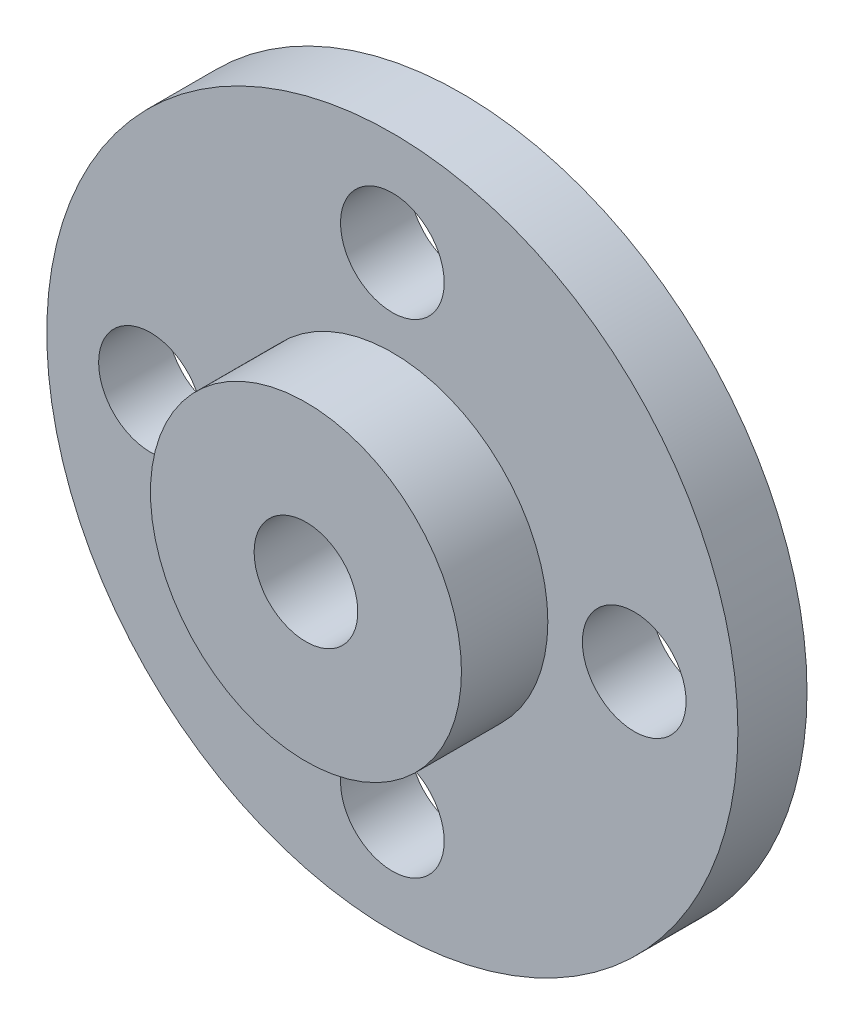
from build123d import *

# Parameters (mm, degrees)
SKETCH_1_R          = 10
EXTRUDE_1_DEPTH     = 2
SKETCH_2_R          = 4.5
EXTRUDE_2_DEPTH     = 2.5
SKETCH_3_R          = 1.5
CUT_EXTRUDE_1_DEPTH = 2.5
SKETCH_4_R          = 1.5
CUT_EXTRUDE_2_DEPTH = 15.84082208


with BuildPart() as part:
    # 草图1 → 凸台-拉伸1 (new body)
    with BuildSketch(Plane.XY):
        Circle(SKETCH_1_R)
    extrude(amount=EXTRUDE_1_DEPTH)

    # 草图2 → 凸台-拉伸2 (add)
    with BuildSketch(Plane.XY.offset(2)):
        Circle(SKETCH_2_R)
    extrude(amount=EXTRUDE_2_DEPTH)

    # 草图3 → 切除-拉伸1 (cut)
    with BuildSketch(Plane(origin=(0, 0, 0), x_dir=(-1, 0, 0), z_dir=(0, 0, -1))):
        with Locations((0, 7)):
            Circle(SKETCH_3_R)
        with Locations((7, 0)):
            Circle(SKETCH_3_R)
        with Locations((0, -7)):
            Circle(SKETCH_3_R)
        with Locations((-7, 0)):
            Circle(SKETCH_3_R)
    extrude(amount=-CUT_EXTRUDE_1_DEPTH, mode=Mode.SUBTRACT)

    # 草图4 → 切除-拉伸2 (cut, through all)
    with BuildSketch(Plane(origin=(0, 0, 0), x_dir=(-1, 0, 0), z_dir=(0, 0, -1))):
        Circle(SKETCH_4_R)
    extrude(amount=-CUT_EXTRUDE_2_DEPTH, mode=Mode.SUBTRACT)


solid = part.part
